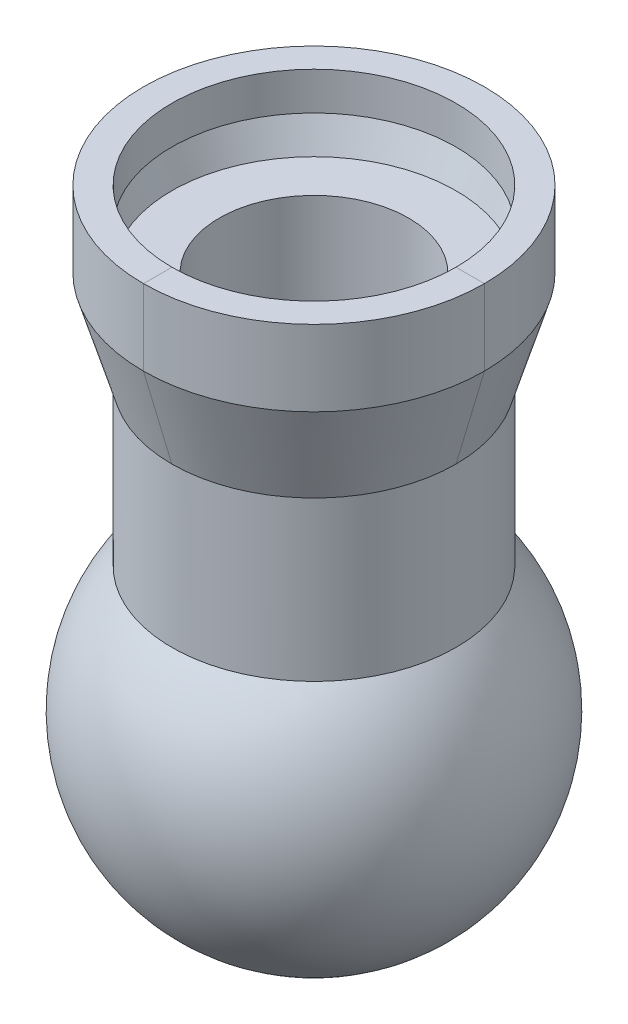
from build123d import *

# Parameters (mm, degrees)
SKETCH_3_R          = 7.5
EXTRUDE_1_DEPTH     = 20
SKETCH_5_R          = 5
CUT_EXTRUDE_1_DEPTH = 34.166247904


with BuildPart() as part:
    # 扫描1: sweep along a path in 草图2
    with BuildLine(Plane(origin=(0, 0, 0), x_dir=(1, 0, 0), z_dir=(0, 1, 0))) as sweep_1_path:
        CenterArc((0, 0), 10, 0, 360)
    # 草图1 → 扫描1 (sweep)
    with BuildSketch(Plane.XY):
        with BuildLine():
            Line((0, 10), (0, -10))
            ThreePointArc((0, -10), (10, 0), (0, 10))
        make_face()
    sweep(path=sweep_1_path.line)

    # 草图3 → 凸台-拉伸1 (add)
    with BuildSketch(Plane(origin=(0, 0, 0), x_dir=(1, 0, 0), z_dir=(0, 1, 0))):
        Circle(SKETCH_3_R)
    extrude(amount=EXTRUDE_1_DEPTH)

    # 扫描2: sweep along a curve in space
    with BuildLine() as sweep_2_path:
        ThreePointArc((0, 20, 7.5), (5.303300859, 20, 5.303300859), (7.5, 20, 0))
        ThreePointArc((7.5, 20, 0), (5.303300859, 20, -5.303300859), (0, 20, -7.5))
        ThreePointArc((0, 20, -7.5), (-5.303300859, 20, -5.303300859), (-7.5, 20, 0))
        ThreePointArc((-7.5, 20, 0), (-5.303300859, 20, 5.303300859), (0, 20, 7.5))
    # 草图4 → 扫描2 (sweep)
    with BuildSketch(Plane.XY):
        Polygon((7.5, 22), (8.3, 22), (7.5, 20), (7.5, 15), (9, 20), (9, 24), (7.5, 24), align=None)
    sweep(path=sweep_2_path.line)

    # 草图5 → 切除-拉伸1 (cut, through all)
    with BuildSketch(Plane(origin=(0, 20, 0), x_dir=(1, 0, 0), z_dir=(0, 1, 0))):
        with Locations(Location((0, 0, 0), (0, 0, 270))):
            Circle(SKETCH_5_R)
    extrude(amount=-CUT_EXTRUDE_1_DEPTH, mode=Mode.SUBTRACT)


solid = part.part
